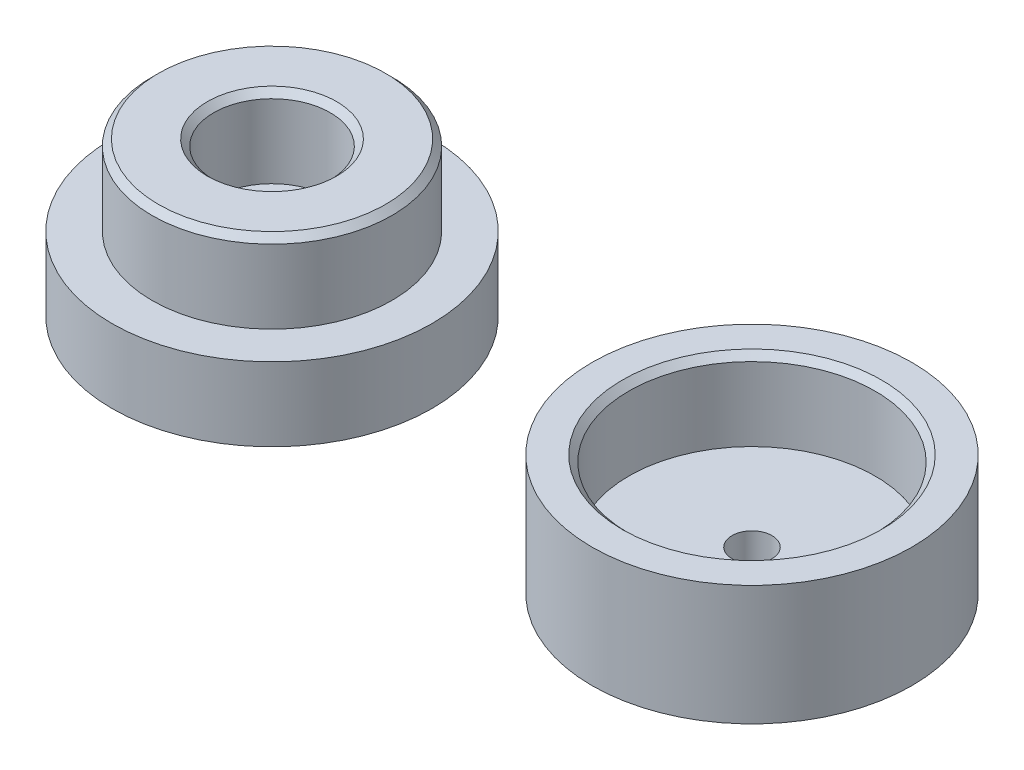
from build123d import *

# Parameters (mm, degrees)
SKETCH2_R               = 6.35
SKETCH2_R_2             = 4.7625
SKETCH2_R_3             = 2.3114
SKETCH2_R_4             = 0.79375
BOSS_EXTRUDE1_DEPTH     = 2.921
BOSS_EXTRUDE2_START     = 2.921
SKETCH2_3_R             = 4.7625
SKETCH2_3_R_2           = 2.3114
BOSS_EXTRUDE2_DEPTH     = 3.175
CHAMFER1_SIZE           = 0.254
SKETCH3_R               = 6.35
BOSS_EXTRUDE3_DEPTH     = 1.5875
BOSS_EXTRUDE4_START     = 1.5875
SKETCH3_3_R             = 6.35
SKETCH3_3_R_2           = 4.8895
BOSS_EXTRUDE4_DEPTH     = 3.175
CUT_EXTRUDE1_DEPTH      = 27.882033331
CUT_EXTRUDE1_DEPTH_BACK = 27.882033331
SKETCH3_4_R             = 0.79375
CHAMFER2_SIZE           = 0.254


with BuildPart() as part:
    # Sketch2 → Boss-Extrude1 (new body)
    # profile 1 of 3: a face of its own
    with BuildSketch(Plane(origin=(0, 0, 0), x_dir=(1, 0, 0), z_dir=(0, 1, 0))):
        with Locations(Location((0, 0, 0), (0, 0, 270))):
            Circle(SKETCH2_R)
        Circle(SKETCH2_R_2, mode=Mode.SUBTRACT)
    # profile 2 of 3: a face of its own
    with BuildSketch(Plane(origin=(0, 0, 0), x_dir=(1, 0, 0), z_dir=(0, 1, 0))):
        Circle(SKETCH2_R_2)
        Circle(SKETCH2_R_3, mode=Mode.SUBTRACT)
    # profile 3 of 3: a face of its own
    with BuildSketch(Plane(origin=(0, 0, 0), x_dir=(1, 0, 0), z_dir=(0, 1, 0))):
        Circle(SKETCH2_R_3)
        with Locations(Location((0, 0, 0), (0, 0, 270))):
            Circle(SKETCH2_R_4, mode=Mode.SUBTRACT)
    extrude(amount=BOSS_EXTRUDE1_DEPTH)

    # Sketch2<3> → Boss-Extrude2 (add)
    with BuildSketch(Plane(origin=(0, 0, 0), x_dir=(1, 0, 0), z_dir=(0, 1, 0)).offset(BOSS_EXTRUDE2_START)):
        with Locations(Location((0, 0, 0), (0, 0, 270))):
            Circle(SKETCH2_3_R)
        with Locations(Location((0, 0, 0), (0, 0, 270))):
            Circle(SKETCH2_3_R_2, mode=Mode.SUBTRACT)
    extrude(amount=BOSS_EXTRUDE2_DEPTH)

    # Chamfer1
    chamfer1_edges = [part.edges().sort_by_distance(p)[0] for p in [
        (0, 6.096, -4.7625),
        (0, 6.096, -2.3114),
    ]]
    chamfer(chamfer1_edges, length=CHAMFER1_SIZE)


with BuildPart() as body_2:
    # Sketch3 → Boss-Extrude3 (new body)
    with BuildSketch(Plane(origin=(0, 0, 0), x_dir=(1, 0, 0), z_dir=(0, 1, 0))):
        with Locations(Location((19.05, 0, 0), (0, 0, 270))):
            Circle(SKETCH3_R)
    extrude(amount=BOSS_EXTRUDE3_DEPTH)

    # Sketch3<3> → Boss-Extrude4 (add)
    with BuildSketch(Plane(origin=(0, 0, 0), x_dir=(1, 0, 0), z_dir=(0, 1, 0)).offset(BOSS_EXTRUDE4_START)):
        with Locations(Location((19.05, 0, 0), (0, 0, 270))):
            Circle(SKETCH3_3_R)
        with Locations(Location((19.05, 0, 0), (0, 0, 270))):
            Circle(SKETCH3_3_R_2, mode=Mode.SUBTRACT)
    extrude(amount=BOSS_EXTRUDE4_DEPTH)

    # Sketch3<4> → Cut-Extrude1 (cut, two sides: drawn at the far end of the back side and taken through both)
    with BuildSketch(Plane(origin=(0, 0, 0), x_dir=(1, 0, 0), z_dir=(0, 1, 0)).offset(-CUT_EXTRUDE1_DEPTH_BACK)):
        with Locations(Location((19.05, 0, 0), (0, 0, 270))):
            Circle(SKETCH3_4_R)
    extrude(amount=CUT_EXTRUDE1_DEPTH + CUT_EXTRUDE1_DEPTH_BACK, mode=Mode.SUBTRACT)

    # Chamfer2
    chamfer2_edges = [body_2.edges().sort_by_distance(p)[0] for p in [
        (19.05, 4.7625, -4.8895),
        (19.05, 0, -0.79375),
    ]]
    chamfer(chamfer2_edges, length=CHAMFER2_SIZE)


solid = Compound([part.part, body_2.part])
